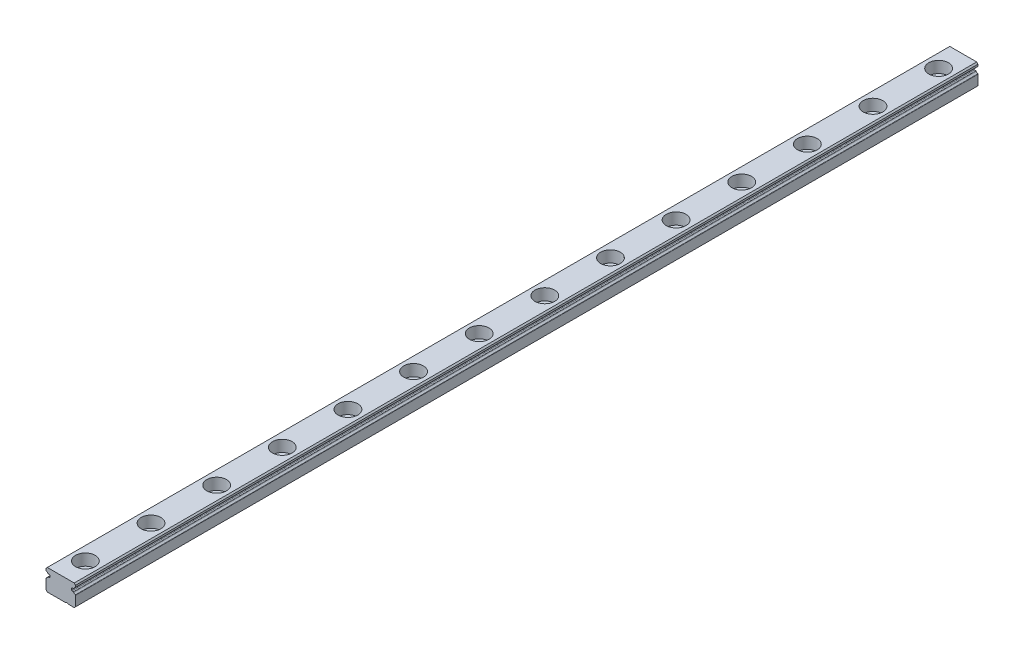
from build123d import *

# Parameters (mm, degrees)
BOSS_EXTRUDE1_START = 137.5
BOSS_EXTRUDE1_DEPTH = 275
LPATTERN1_COUNT     = 14
LPATTERN1_PITCH     = 20


with BuildPart() as part:
    # Sketch3 → Boss-Extrude1 (new body)
    with BuildSketch(Plane.XY.offset(BOSS_EXTRUDE1_START)):
        with BuildLine():
            Line((-4.5, 0.191696476), (-4.5, -2.85))
            Line((-4.5, -2.85), (-4.1, -3.25))
            Line((-4.1, -3.25), (1.4, -3.25))
            ThreePointArc((1.4, -3.25), (1.8, -3.05), (2.2, -3.25))
            Line((2.2, -3.25), (4.1, -3.25))
            Line((4.1, -3.25), (4.5, -2.85))
            Line((4.5, -2.85), (4.5, 0.191696476))
            ThreePointArc((4.5, 0.191696476), (4.475108648, 0.274448068), (4.408695652, 0.329735674))
            ThreePointArc((4.408695652, 0.329735674), (4.141262777, 0.497623907), (3.939510483, 0.740528855))
            ThreePointArc((3.939510483, 0.740528855), (3.890337026, 0.791057421), (3.823510417, 0.813537838))
            Line((3.823510417, 0.813537838), (3.482568852, 0.84336636))
            ThreePointArc((3.482568852, 0.84336636), (3.352544533, 0.907487258), (3.3, 1.042605299))
            Line((3.3, 1.042605299), (3.3, 1.457394701))
            ThreePointArc((3.3, 1.457394701), (3.352544533, 1.592512742), (3.482568852, 1.65663364))
            Line((3.482568852, 1.65663364), (3.823514163, 1.68646249))
            ThreePointArc((3.823514163, 1.68646249), (3.890340367, 1.708942652), (3.939513741, 1.759470648))
            ThreePointArc((3.939513741, 1.759470648), (4.141265182, 2.002372199), (4.408695652, 2.170258326))
            ThreePointArc((4.408695652, 2.170258326), (4.475108648, 2.225545932), (4.5, 2.308297524))
            Line((4.5, 2.308297524), (4.5, 2.85))
            Line((4.5, 2.85), (4.1, 3.25))
            Line((4.1, 3.25), (-4.1, 3.25))
            Line((-4.1, 3.25), (-4.5, 2.85))
            Line((-4.5, 2.85), (-4.5, 2.308297524))
            ThreePointArc((-4.5, 2.308297524), (-4.475108648, 2.225545932), (-4.408695652, 2.170258326))
            ThreePointArc((-4.408695652, 2.170258326), (-4.141265182, 2.002372199), (-3.939513741, 1.759470648))
            ThreePointArc((-3.939513741, 1.759470648), (-3.890340367, 1.708942652), (-3.823514163, 1.68646249))
            Line((-3.823514163, 1.68646249), (-3.482568852, 1.65663364))
            ThreePointArc((-3.482568852, 1.65663364), (-3.352544533, 1.592512742), (-3.3, 1.457394701))
            Line((-3.3, 1.457394701), (-3.3, 1.042605299))
            ThreePointArc((-3.3, 1.042605299), (-3.352544533, 0.907487258), (-3.482568852, 0.84336636))
            Line((-3.482568852, 0.84336636), (-3.823510417, 0.813537838))
            ThreePointArc((-3.823510417, 0.813537838), (-3.890337026, 0.791057421), (-3.939510483, 0.740528855))
            ThreePointArc((-3.939510483, 0.740528855), (-4.141262777, 0.497623907), (-4.408695652, 0.329735674))
            ThreePointArc((-4.408695652, 0.329735674), (-4.475108648, 0.274448068), (-4.5, 0.191696476))
        make_face()
    extrude(amount=-BOSS_EXTRUDE1_DEPTH)

    # Sketch4 → Cut-Revolve1 (revolve, cut)
    with BuildSketch(Plane.XY.offset(130)):
        Polygon((0, 3.25), (0, -3.25), (-1.75, -3.25), (-1.75, -0.25), (-3, -0.25), (-3, 3.25), align=None)
    cut_revolve1 = revolve(axis=Axis((0, 3.25, 130), (0, -1, 0)), mode=Mode.SUBTRACT)

    # LPattern1: Cut-Revolve1 ×14
    with Locations(*[(0, 0, -i * LPATTERN1_PITCH) for i in range(1, LPATTERN1_COUNT)]):
        add(cut_revolve1, mode=Mode.SUBTRACT)


solid = part.part
